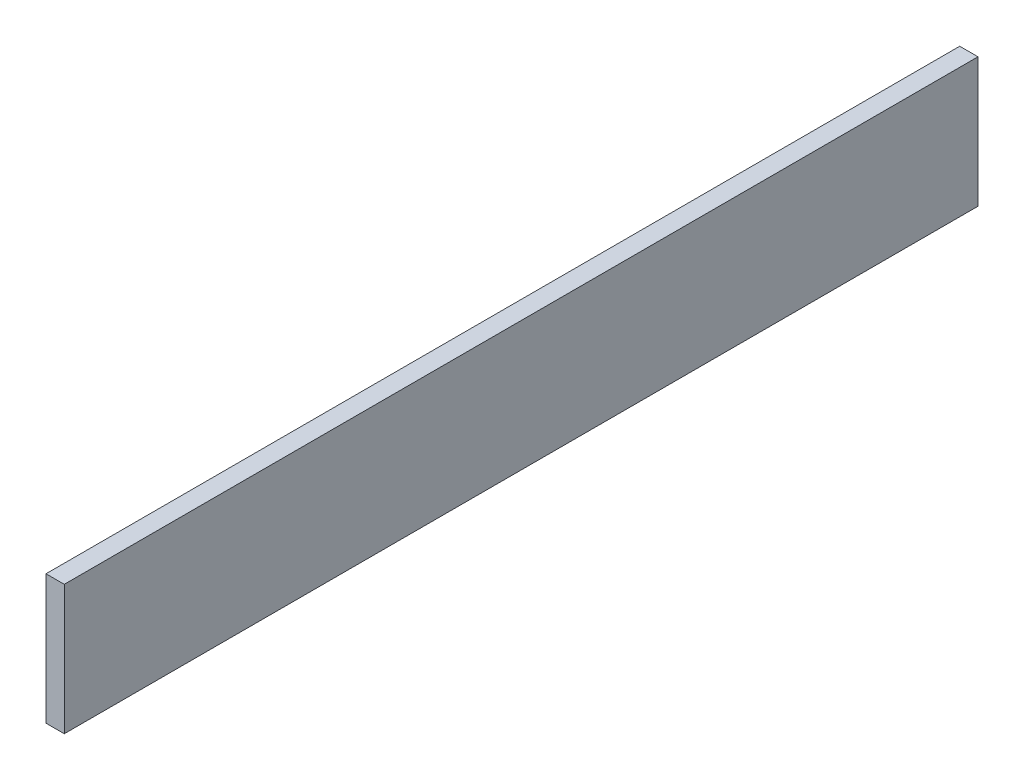
from build123d import *

# Parameters (mm, degrees)
SKETCH1_W           = 300
SKETCH1_H           = 42.5
BOSS_EXTRUDE1_DEPTH = 6


with BuildPart() as part:
    # Sketch1 → Boss-Extrude1 (new body)
    with BuildSketch(Plane(origin=(0, 0, 0), x_dir=(0, 0, -1), z_dir=(1, 0, 0))):
        Rectangle(SKETCH1_W, SKETCH1_H)
    extrude(amount=BOSS_EXTRUDE1_DEPTH)


solid = part.part
